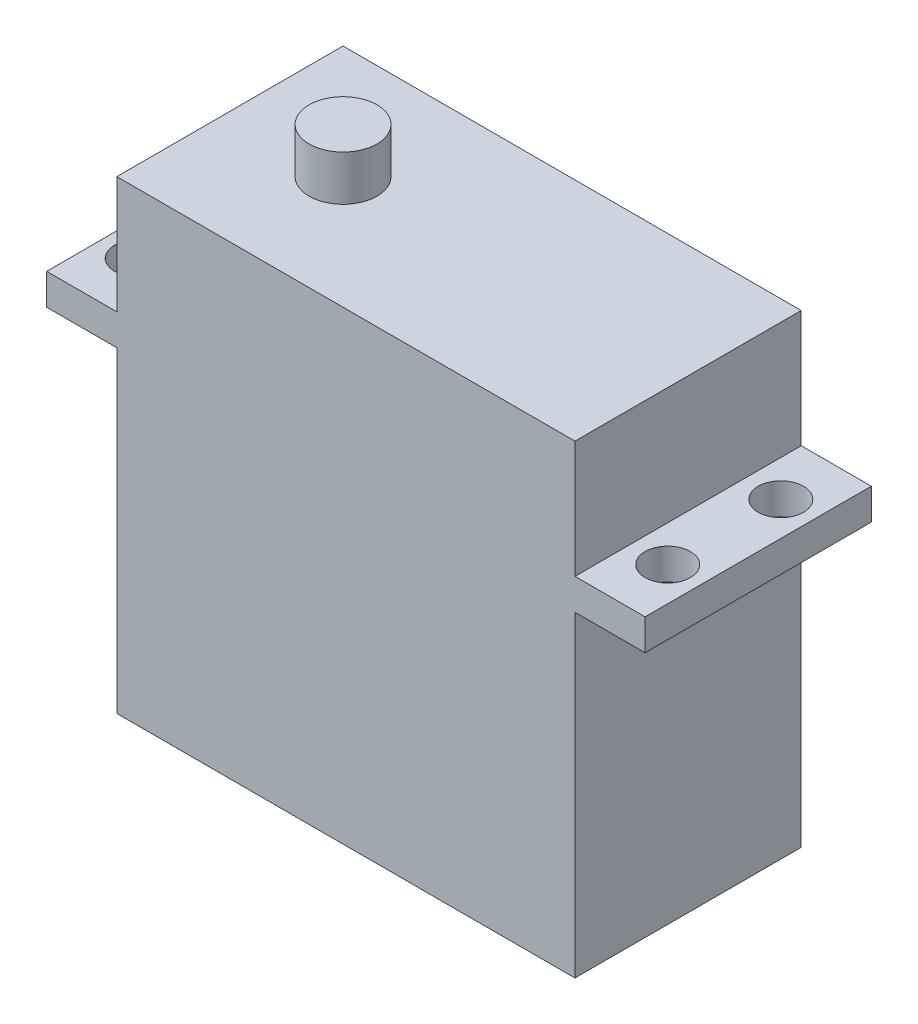
from build123d import *

# Parameters (mm, degrees)
SKETCH_1_W          = 40.5
SKETCH_1_H          = 41.1
EXTRUDE_1_DEPTH     = 20
SKETCH_2_W          = 20
SKETCH_2_H          = 2.75
EXTRUDE_2_DEPTH     = 6.2
SKETCH_3_R          = 2
CUT_EXTRUDE_1_DEPTH = 6.2
SKETCH_4_R          = 3
EXTRUDE_3_DEPTH     = 4


with BuildPart() as part:
    # 草图1 → 凸台-拉伸1 (new body)
    with BuildSketch(Plane.XY):
        Rectangle(SKETCH_1_W, SKETCH_1_H)
    extrude(amount=-EXTRUDE_1_DEPTH)

    # 草图2 → 凸台-拉伸2 (add)
    with BuildSketch(Plane(origin=(20.25, 0, 0), x_dir=(0, 0, -1), z_dir=(1, 0, 0))):
        with Locations((10, 8.825)):
            Rectangle(SKETCH_2_W, SKETCH_2_H)
    extrude_2 = extrude(amount=EXTRUDE_2_DEPTH)

    # 草图3 → 切除-拉伸1 (cut)
    with BuildSketch(Plane(origin=(0, 10.2, 0), x_dir=(1, 0, 0), z_dir=(0, 1, 0))):
        with Locations(Location((23.45, 5, 0), (0, 0, 270))):
            Circle(SKETCH_3_R)
        with Locations(Location((23.45, 15, 0), (0, 0, 270))):
            Circle(SKETCH_3_R)
    cut_extrude_1 = extrude(amount=-CUT_EXTRUDE_1_DEPTH, mode=Mode.SUBTRACT)

    # 镜向2: 凸台-拉伸2, 切除-拉伸1 across plane
    add(extrude_2.mirror(Plane(origin=(0, 0, 0), x_dir=(0, 0, 1), z_dir=(1, 0, 0))))
    add(cut_extrude_1.mirror(Plane(origin=(0, 0, 0), x_dir=(0, 0, 1), z_dir=(1, 0, 0))), mode=Mode.SUBTRACT)

    # 草图4 → 凸台-拉伸3 (add)
    with BuildSketch(Plane(origin=(0, 20.55, 0), x_dir=(1, 0, 0), z_dir=(0, 1, 0))):
        with Locations(Location((-10.25, 10, 0), (0, 0, 270))):
            Circle(SKETCH_4_R)
    extrude(amount=EXTRUDE_3_DEPTH)


solid = part.part
